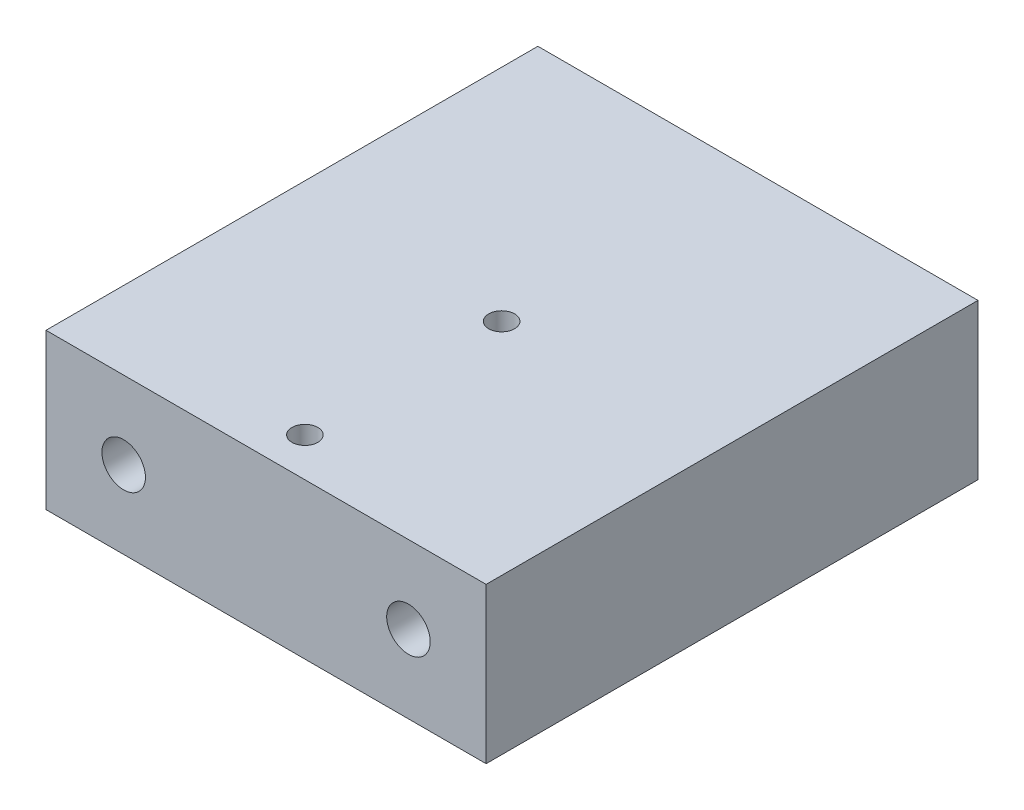
from build123d import *

# Parameters (mm, degrees)
SKIZZE1_W                       = 42.5
SKIZZE1_H                       = 15
AUFSATZ_LINEAR_AUSTRAGEN1_DEPTH = 47.5
M5_GEWINDEBOHRUNG1_D            = 4.2
M5_GEWINDEBOHRUNG1_DEPTH        = 10
M5_GEWINDEBOHRUNG1_TIP          = 1.2618073
M5_GEWINDEBOHRUNG2_D            = 4.2
M5_GEWINDEBOHRUNG2_DEPTH        = 10
M5_GEWINDEBOHRUNG2_TIP          = 1.2618073
M3_GEWINDEBOHRUNG1_D            = 2.5
M3_GEWINDEBOHRUNG1_DEPTH        = 8.5
M3_GEWINDEBOHRUNG1_TIP          = 0.751075774


with BuildPart() as part:
    # Skizze1 → Aufsatz-Linear austragen1 (new body)
    with BuildSketch(Plane.XY):
        with Locations((21.25, 7.5)):
            Rectangle(SKIZZE1_W, SKIZZE1_H)
    extrude(amount=AUFSATZ_LINEAR_AUSTRAGEN1_DEPTH)

    # M5 Gewindebohrung1
    with Locations(Plane(origin=(0, 0, 0), x_dir=(-1, 0, 0), z_dir=(0, 0, -1))):
        with Locations((-7.5, 7.5), (-35, 7.5)):
            Hole(M5_GEWINDEBOHRUNG1_D / 2, depth=M5_GEWINDEBOHRUNG1_DEPTH)
            with Locations((0, 0, -(M5_GEWINDEBOHRUNG1_DEPTH + M5_GEWINDEBOHRUNG1_TIP / 2))):  # 118° drill point
                Cone(0, M5_GEWINDEBOHRUNG1_D / 2, M5_GEWINDEBOHRUNG1_TIP, mode=Mode.SUBTRACT)

    # M5 Gewindebohrung2
    with Locations(Plane(origin=(7.5, 7.5, 47.5), x_dir=(1, 0, 0), z_dir=(0, 0, 1))):
        with Locations((0, 0), (27.5, 0)):
            Hole(M5_GEWINDEBOHRUNG2_D / 2, depth=M5_GEWINDEBOHRUNG2_DEPTH)
            with Locations((0, 0, -(M5_GEWINDEBOHRUNG2_DEPTH + M5_GEWINDEBOHRUNG2_TIP / 2))):  # 118° drill point
                Cone(0, M5_GEWINDEBOHRUNG2_D / 2, M5_GEWINDEBOHRUNG2_TIP, mode=Mode.SUBTRACT)

    # M3 Gewindebohrung1
    with Locations(Plane(origin=(21.25, 15, 43.75), x_dir=(0, 0, 1), z_dir=(0, 1, 0))):
        with Locations((0, 0), (-19, 0)):
            Hole(M3_GEWINDEBOHRUNG1_D / 2, depth=M3_GEWINDEBOHRUNG1_DEPTH)
            with Locations((0, 0, -(M3_GEWINDEBOHRUNG1_DEPTH + M3_GEWINDEBOHRUNG1_TIP / 2))):  # 118° drill point
                Cone(0, M3_GEWINDEBOHRUNG1_D / 2, M3_GEWINDEBOHRUNG1_TIP, mode=Mode.SUBTRACT)


solid = part.part
